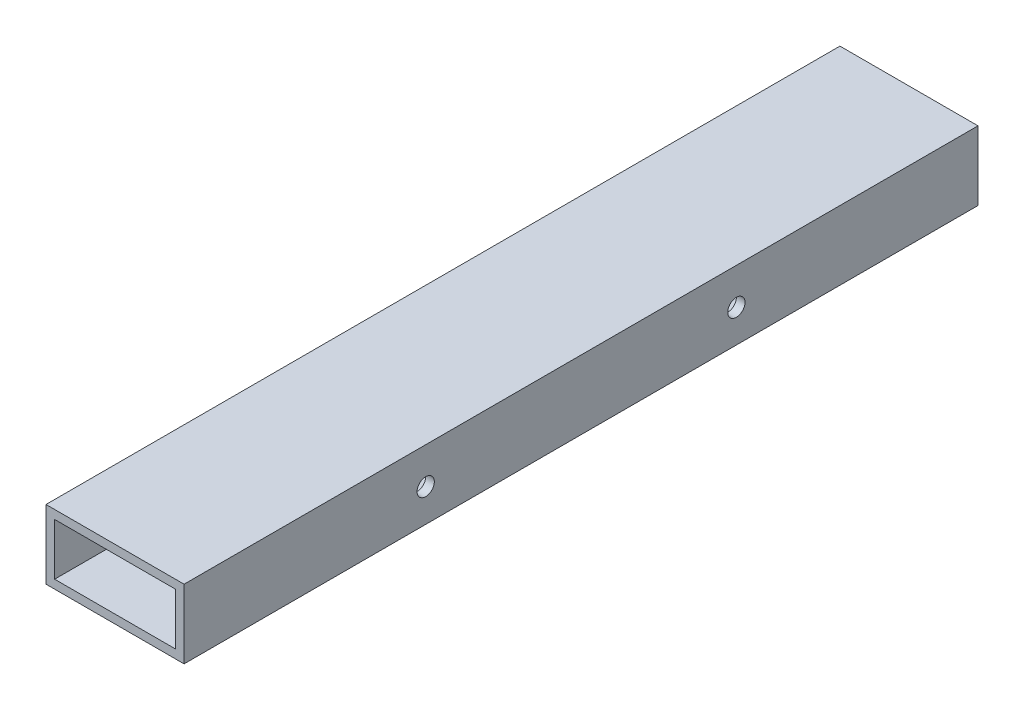
from build123d import *

# Parameters (mm, degrees)
SKETCH1_W               = 50.8
SKETCH1_H               = 25.4
SKETCH1_W_2             = 44.45
SKETCH1_H_2             = 19.05
BOSS_EXTRUDE1_DEPTH     = 292.1
CUT_EXTRUDE1_DEPTH      = 298.570512652
CUT_EXTRUDE1_DEPTH_BACK = 298.570512652
SKETCH2_R               = 3.175


with BuildPart() as part:
    # Sketch1 → Boss-Extrude1 (new body)
    with BuildSketch(Plane.XY):
        with Locations((25.4, 12.7)):
            Rectangle(SKETCH1_W, SKETCH1_H)
        with Locations((25.4, 12.7)):
            Rectangle(SKETCH1_W_2, SKETCH1_H_2, mode=Mode.SUBTRACT)
    extrude(amount=BOSS_EXTRUDE1_DEPTH)

    # Sketch2 → Cut-Extrude1 (cut, two sides: drawn at the far end of the back side and taken through both)
    with BuildSketch(Plane(origin=(50.8, 0, 0), x_dir=(0, 0, -1), z_dir=(1, 0, 0)).offset(-CUT_EXTRUDE1_DEPTH_BACK)):
        with Locations((-203.2, 12.026758398)):
            Circle(SKETCH2_R)
        with Locations((-88.9, 12.026758398)):
            Circle(SKETCH2_R)
    extrude(amount=CUT_EXTRUDE1_DEPTH + CUT_EXTRUDE1_DEPTH_BACK, mode=Mode.SUBTRACT)


solid = part.part
